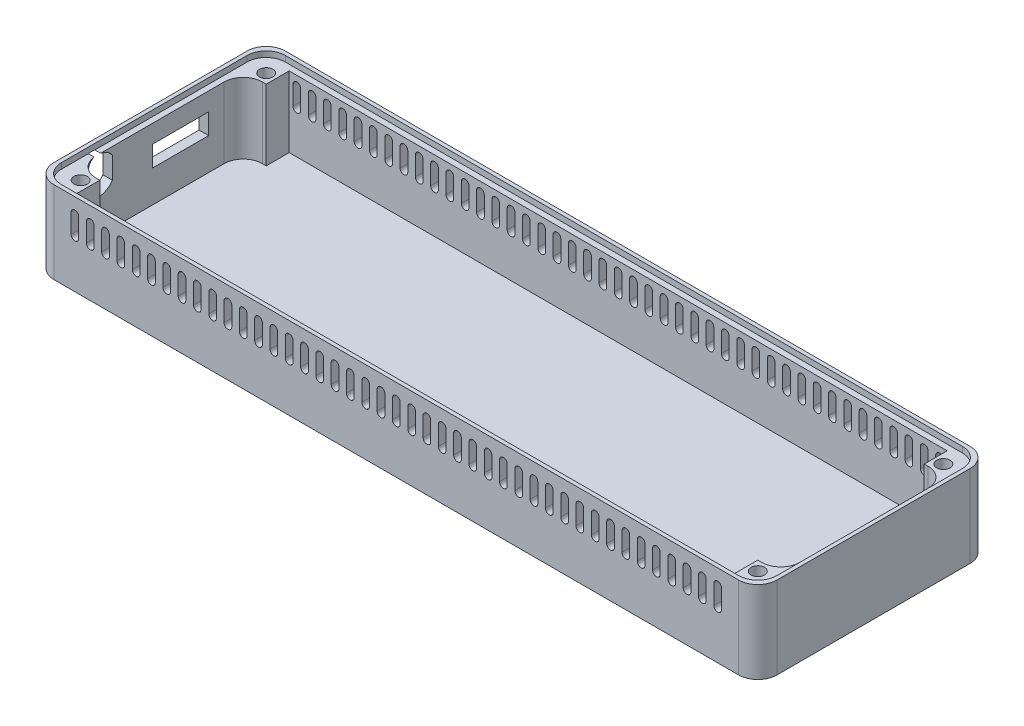
from build123d import *

# Parameters (mm, degrees)
SKETCH1_W           = 189
SKETCH1_H           = 60.5
SKETCH1_W_2         = 165
SKETCH1_H_2         = 55.5
BOSS_EXTRUDE1_DEPTH = 1.5
SKETCH2_W           = 189
SKETCH2_H           = 60.5
SKETCH2_W_2         = 184
SKETCH2_H_2         = 55.5
EXTRUDE_THIN1_DEPTH = 20
CUT_EXTRUDE1_REACH  = 194.609
CUT_EXTRUDE2_REACH  = 194.609
SKETCH4_W           = 14.642979494
SKETCH4_H           = 5.381607848
SKETCH5_W           = 6
SKETCH5_H           = 6
BOSS_EXTRUDE2_DEPTH = 20
SKETCH6_W           = 187
SKETCH6_H           = 58.5
CUT_EXTRUDE3_DEPTH  = 1.5
FILLET1_R           = 5
FILLET2_R           = 5
FILLET3_R           = 5
HOLE1_D             = 2.5
HOLE1_DEPTH         = 6
HOLE1_CBORE_D       = 3.5
HOLE1_CBORE_DEPTH   = 2.95
CUT_EXTRUDE4_DEPTH  = 118.578697134
LPATTERN1_COUNT     = 23
LPATTERN1_PITCH     = 4
LPATTERN2_COUNT     = 21
LPATTERN2_PITCH     = 4


with BuildPart() as part:
    # Sketch1 → Boss-Extrude1 (new body)
    # profile 1 of 2: a face of its own
    with BuildSketch(Plane(origin=(0, 0, 0), x_dir=(1, 0, 0), z_dir=(0, 1, 0))):
        with Locations((-4, 0)):
            Rectangle(SKETCH1_W, SKETCH1_H)
        Rectangle(SKETCH1_W_2, SKETCH1_H_2, mode=Mode.SUBTRACT)
    # profile 2 of 2: a face of its own
    with BuildSketch(Plane(origin=(0, 0, 0), x_dir=(1, 0, 0), z_dir=(0, 1, 0))):
        Rectangle(SKETCH1_W_2, SKETCH1_H_2)
    extrude(amount=BOSS_EXTRUDE1_DEPTH)

    # Sketch2 → Extrude-Thin1 (add)
    with BuildSketch(Plane(origin=(0, 1.5, 0), x_dir=(1, 0, 0), z_dir=(0, 1, 0))):
        with Locations((-4, 0)):
            Rectangle(SKETCH2_W, SKETCH2_H)
        with Locations((-4, 0)):
            Rectangle(SKETCH2_W_2, SKETCH2_H_2, mode=Mode.SUBTRACT)
    extrude(amount=EXTRUDE_THIN1_DEPTH)

    # Sketch3 → Cut-Extrude1 (cut, up to next)
    with BuildSketch(Plane.ZY.offset(98.5), mode=Mode.PRIVATE) as cut_extrude1_sk1:
        with BuildLine():
            Line((20.350445445, 18.052951997), (20.350445445, 12.332958636))
            ThreePointArc((20.350445445, 12.332958636), (16.395130886, 10.311962152), (12.439816328, 12.332958636))
            Line((12.439816328, 12.332958636), (12.439816328, 18.052951997))
            ThreePointArc((12.439816328, 18.052951997), (16.395130886, 20.073948481), (20.350445445, 18.052951997))
        make_face()
    cut_extrude1_tool1 = extrude(cut_extrude1_sk1.sketch, amount=-CUT_EXTRUDE1_REACH, mode=Mode.PRIVATE) & part.part
    add(cut_extrude1_tool1.solids().sort_by_distance((-98.5, 15.192955, 16.395131))[0], mode=Mode.SUBTRACT)

    # Sketch4 → Cut-Extrude2 (cut, up to next)
    with BuildSketch(Plane.ZY.offset(98.5), mode=Mode.PRIVATE) as cut_extrude2_sk1:
        with Locations((-5.381607848, 12.564728228)):
            Rectangle(SKETCH4_W, SKETCH4_H)
    cut_extrude2_tool1 = extrude(cut_extrude2_sk1.sketch, amount=-CUT_EXTRUDE2_REACH, mode=Mode.PRIVATE) & part.part
    add(cut_extrude2_tool1.solids().sort_by_distance((-98.5, 12.564728, -5.381608))[0], mode=Mode.SUBTRACT)

    # Sketch5 → Boss-Extrude2 (add, through all)
    with BuildSketch(Plane(origin=(0, 1.5, 0), x_dir=(1, 0, 0), z_dir=(0, 1, 0))):
        with Locations((-93, 24.75)):
            Rectangle(SKETCH5_W, SKETCH5_H)
        with Locations((85, 24.75)):
            Rectangle(SKETCH5_W, SKETCH5_H)
        with Locations((85, -24.75)):
            Rectangle(SKETCH5_W, SKETCH5_H)
        with Locations((-93, -24.75)):
            Rectangle(SKETCH5_W, SKETCH5_H)
    extrude(amount=BOSS_EXTRUDE2_DEPTH)

    # Sketch6 → Cut-Extrude3 (cut)
    with BuildSketch(Plane(origin=(0, 21.5, 0), x_dir=(1, 0, 0), z_dir=(0, 1, 0))):
        with Locations((-4, 0)):
            Rectangle(SKETCH6_W, SKETCH6_H)
    extrude(amount=-CUT_EXTRUDE3_DEPTH, mode=Mode.SUBTRACT)

    # Fillet1
    fillet1_edges = [part.edges().sort_by_distance(p)[0] for p in [
        (88, 10.75, -21.75),
        (88, 10.75, 21.75),
        (-96, 10.75, 21.75),
        (-96, 10.75, -21.75),
    ]]
    fillet(fillet1_edges, radius=FILLET1_R)

    # Fillet2
    fillet2_edges = [part.edges().sort_by_distance(p)[0] for p in [
        (-97.5, 20.75, 29.25),
        (89.5, 20.75, -29.25),
        (89.5, 20.75, 29.25),
        (-97.5, 20.75, -29.25),
    ]]
    fillet(fillet2_edges, radius=FILLET2_R)

    # Fillet3
    fillet3_edges = [part.edges().sort_by_distance(p)[0] for p in [
        (-98.5, 10.75, -30.25),
        (90.5, 10.75, -30.25),
        (90.5, 10.75, 30.25),
        (-98.5, 10.75, 30.25),
    ]]
    fillet(fillet3_edges, radius=FILLET3_R)

    # Hole1
    with Locations(Plane(origin=(0, 20, 0), x_dir=(1, 0, 0), z_dir=(0, 1, 0))):
        with Locations((-92.5, 24.25), (-92.5, -24.25), (84.5, -24.25), (84.5, 24.25)):
            CounterBoreHole(HOLE1_D / 2, HOLE1_CBORE_D / 2, HOLE1_CBORE_DEPTH, depth=HOLE1_DEPTH)

    # Sketch9 → Cut-Extrude4 (cut, through all)
    with BuildSketch(Plane.XY.offset(30.25)):
        with BuildLine():
            Line((-1, 12.5), (-1, 17.5))
            ThreePointArc((-1, 17.5), (0, 18.5), (1, 17.5))
            Line((1, 17.5), (1, 12.5))
            ThreePointArc((1, 12.5), (0, 11.5), (-1, 12.5))
        make_face()
    cut_extrude4 = extrude(amount=-CUT_EXTRUDE4_DEPTH, mode=Mode.SUBTRACT)

    # LPattern1: Cut-Extrude4 ×23
    with Locations(*[(-i * LPATTERN1_PITCH, 0, 0) for i in range(1, LPATTERN1_COUNT)]):
        add(cut_extrude4, mode=Mode.SUBTRACT)

    # LPattern2: Cut-Extrude4 ×21
    with Locations(*[(i * LPATTERN2_PITCH, 0, 0) for i in range(1, LPATTERN2_COUNT)]):
        add(cut_extrude4, mode=Mode.SUBTRACT)


solid = part.part
